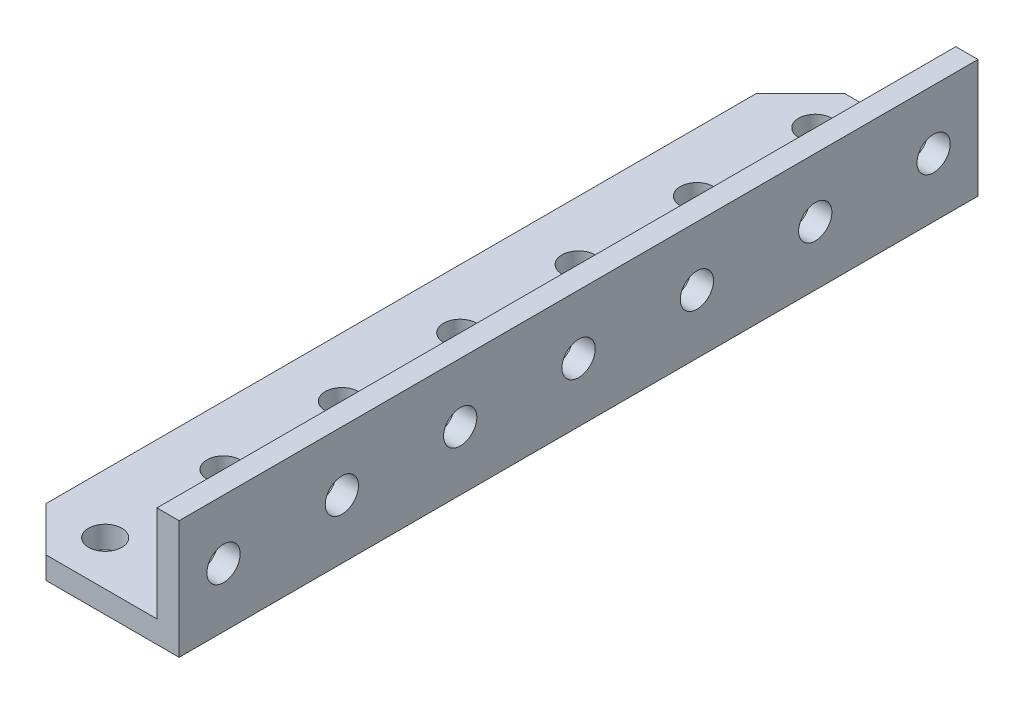
from build123d import *

# Parameters (mm, degrees)
BOSS_EXTRUDE1_DEPTH         = 177.8
F_1_4_CLEARANCE_HOLE1_D     = 7.14248
F_1_4_CLEARANCE_HOLE2_D     = 7.14248
F_1_4_CLEARANCE_HOLE2_DEPTH = 4.7625
CHAMFER1_SIZE               = 12.7
SKETCH10_W                  = 38.1
SKETCH10_H                  = 25.4
CUT_EXTRUDE1_DEPTH          = 3.175


with BuildPart() as part:
    # Sketch1 → Boss-Extrude1 (new body)
    with BuildSketch(Plane.XY):
        Polygon((0, 0), (38.1, 0), (38.1, 25.4), (33.3375, 25.4), (33.3375, 4.7625), (0, 4.7625), align=None)
    extrude(amount=BOSS_EXTRUDE1_DEPTH)

    # 1/4 Clearance Hole1 (through all)
    with Locations(Plane(origin=(0, 4.7625, 0), x_dir=(1, 0, 0), z_dir=(0, 1, 0))):
        with Locations((12.7, -12.7), (12.7, -165.1), (12.7, -139.7), (12.7, -114.3), (12.7, -88.9), (12.7, -63.5), (12.7, -38.1)):
            Hole(F_1_4_CLEARANCE_HOLE1_D / 2)

    # 1/4 Clearance Hole2
    with Locations(Plane.ZY.offset(-33.3375)):
        with Locations((190.5, 12.7), (12.7, 12.7), (38.1, 12.7), (63.5, 12.7), (88.9, 12.7), (114.3, 12.7), (139.7, 12.7), (165.1, 12.7)):
            Hole(F_1_4_CLEARANCE_HOLE2_D / 2, depth=F_1_4_CLEARANCE_HOLE2_DEPTH)

    # Chamfer1
    chamfer1_edges = [part.edges().sort_by_distance(p)[0] for p in [
        (0, 2.38125, 177.8),
        (0, 2.38125, 0),
    ]]
    chamfer(chamfer1_edges, length=CHAMFER1_SIZE)

    # Sketch10 → Cut-Extrude1 (cut)
    with BuildSketch(Plane(origin=(0, 0, 0), x_dir=(-1, 0, 0), z_dir=(0, 0, -1))):
        with Locations((-19.05, 12.7)):
            Rectangle(SKETCH10_W, SKETCH10_H)
    cut_extrude1 = extrude(amount=-CUT_EXTRUDE1_DEPTH, mode=Mode.SUBTRACT)

    # Mirror1: Cut-Extrude1 across plane
    add(cut_extrude1.mirror(Plane(origin=(0, 0, 88.9), x_dir=(1, 0, 0), z_dir=(0, 0, -1))), mode=Mode.SUBTRACT)


solid = part.part
